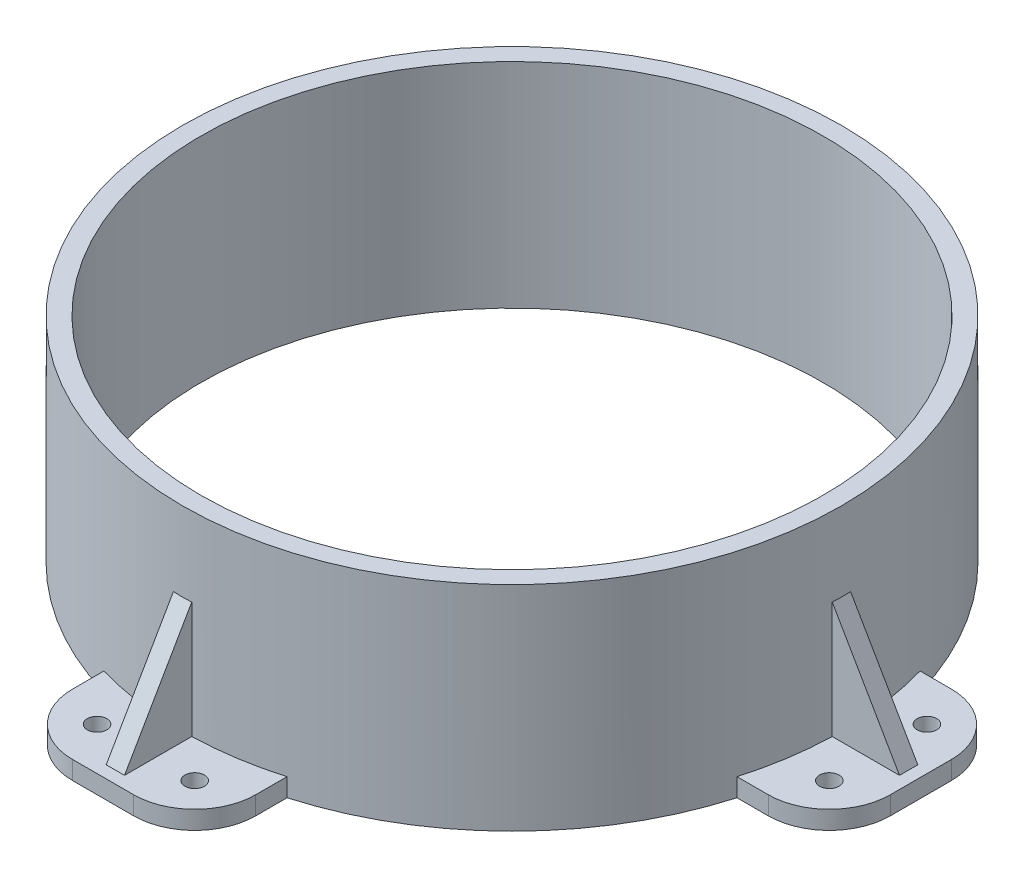
from build123d import *

# Parameters (mm, degrees)
SKETCH_1_W                       = 30
SKETCH_1_H                       = 30
EXTRUDE_1_DEPTH                  = 3
EXTRUDE_2_DEPTH                  = 1.5
FILLET_2_R                       = 10
SKETCH_4_R                       = 51
CUT_EXTRUDE_1_DEPTH              = 80
SKETCH_5_R                       = 1.6
CUT_EXTRUDE_3_DEPTH              = 10
SHEET_EXTRUDE_2_1_DEPTH          = 35
THICKEN_2_T2                     = 3
PATTERN_CIRCULAR_8_COUNT         = 4
FILLET_2_OF_PATTERN_CIRCULAR_8_R = 10
SKETCH_6_R                       = 51
CUT_EXTRUDE_4_DEPTH              = 35


with BuildPart() as part:
    # 草图1 → 凸台-拉伸1 (new body)
    with BuildSketch(Plane(origin=(0, 0, 0), x_dir=(1, 0, 0), z_dir=(0, 1, 0))):
        Rectangle(SKETCH_1_W, SKETCH_1_H)
    extrude_1 = extrude(amount=EXTRUDE_1_DEPTH)

    # 草图3 → 凸台-拉伸2 (add, symmetric)
    with BuildSketch(Plane.XY):
        Polygon((-13, 3), (4.320508076, 33), (50, 33), (50, 3), align=None)
    extrude_2 = extrude(amount=EXTRUDE_2_DEPTH, both=True)

    # 圆角2
    fillet_2_edges = [part.edges().sort_by_distance(p)[0] for p in [
        (-15, 1.5, 15),
        (-15, 1.5, -15),
    ]]
    fillet(fillet_2_edges, radius=FILLET_2_R)

    # 草图4 → 切除-拉伸1 (cut)
    with BuildSketch(Plane(origin=(0, 0, 0), x_dir=(1, 0, 0), z_dir=(0, 1, 0))):
        with Locations((52, 0)):
            Circle(SKETCH_4_R)
    extrude(amount=CUT_EXTRUDE_1_DEPTH, mode=Mode.SUBTRACT)

    # 草图5 → 切除-拉伸3 (cut)
    with BuildSketch(Plane(origin=(0, 0, 0), x_dir=(1, 0, 0), z_dir=(0, 1, 0))):
        with Locations(Location((-8, 8, 0), (0, 0, 90))):
            Circle(SKETCH_5_R)
        with Locations(Location((-8, -8, 0), (0, 0, 90))):
            Circle(SKETCH_5_R)
    cut_extrude_3 = extrude(amount=CUT_EXTRUDE_3_DEPTH, mode=Mode.SUBTRACT)

    # Sheet 凸台-拉伸2: a surface, the sketch's curves swept straight by 35 mm
    with BuildLine(Plane(origin=(0, 0, 0), x_dir=(1, 0, 0), z_dir=(0, 1, 0)), mode=Mode.PRIVATE) as sheet_extrude_2_1_path:
        CenterArc((52, 0), 51, 0, 360)
    sheet_extrude_2_1 = Shell.extrude(sheet_extrude_2_1_path.wire(), (0 * SHEET_EXTRUDE_2_1_DEPTH, 1 * SHEET_EXTRUDE_2_1_DEPTH, 0 * SHEET_EXTRUDE_2_1_DEPTH))
    add(Solid.thicken(sheet_extrude_2_1, -THICKEN_2_T2))

    # 阵列(圆周)8: 凸台-拉伸1, 凸台-拉伸2, 切除-拉伸3 ×4 about axis
    pattern_circular_8_axis = Axis((52, 0, 0), (0, 1, 0))
    add([extrude_1.rotate(pattern_circular_8_axis, i * 360 / PATTERN_CIRCULAR_8_COUNT) for i in range(1, PATTERN_CIRCULAR_8_COUNT)])
    add([extrude_2.rotate(pattern_circular_8_axis, i * 360 / PATTERN_CIRCULAR_8_COUNT) for i in range(1, PATTERN_CIRCULAR_8_COUNT)])
    add([cut_extrude_3.rotate(pattern_circular_8_axis, i * 360 / PATTERN_CIRCULAR_8_COUNT) for i in range(1, PATTERN_CIRCULAR_8_COUNT)], mode=Mode.SUBTRACT)

    # 圆角2 of 阵列(圆周)8
    fillet_2_of_pattern_circular_8_edges = [part.edges().sort_by_distance(p)[0] for p in [
        (67, 1.5, 67),
        (37, 1.5, 67),
        (119, 1.5, -15),
        (119, 1.5, 15),
        (37, 1.5, -67),
        (67, 1.5, -67),
    ]]
    fillet(fillet_2_of_pattern_circular_8_edges, radius=FILLET_2_OF_PATTERN_CIRCULAR_8_R)

    # 草图6 → 切除-拉伸4 (cut)
    with BuildSketch(Plane(origin=(0, 0, 0), x_dir=(1, 0, 0), z_dir=(0, 1, 0))):
        with Locations(Location((52, 0, 0), (0, 0, 270))):
            Circle(SKETCH_6_R)
    extrude(amount=CUT_EXTRUDE_4_DEPTH, mode=Mode.SUBTRACT)


solid = part.part
